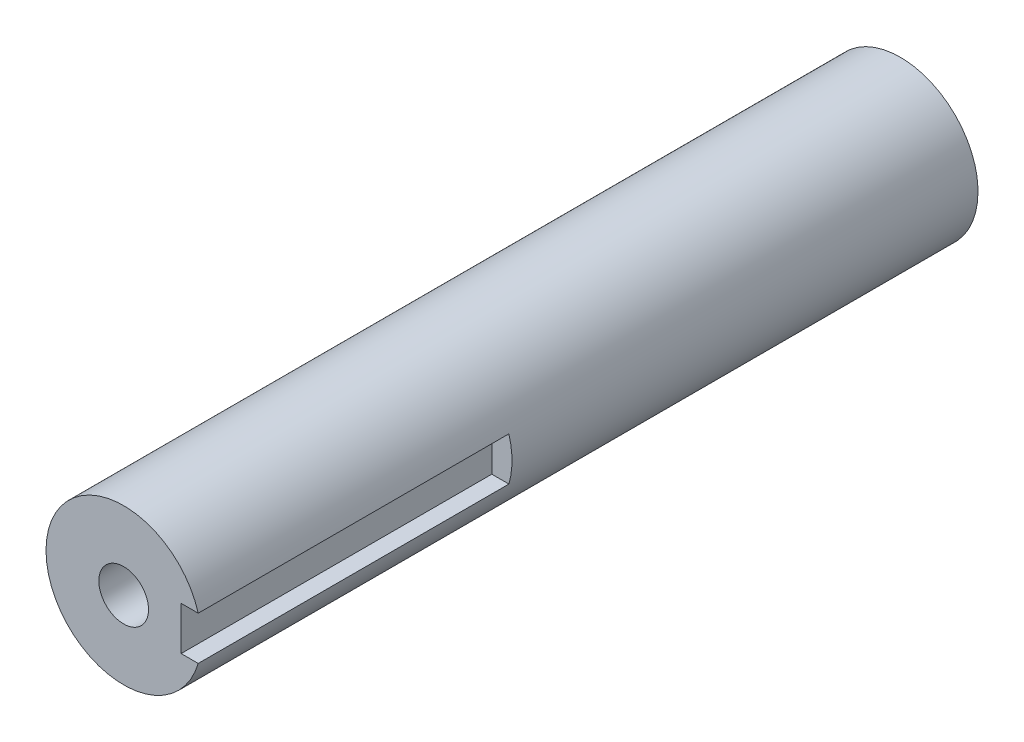
from build123d import *

# Parameters (mm, degrees)
SKETCH_1_R          = 25
EXTRUDE_1_DEPTH     = 250
SKETCH_2_W          = 14
SKETCH_2_H          = 10
CUT_EXTRUDE_1_DEPTH = 100
SKETCH_3_R          = 8
CUT_EXTRUDE_2_DEPTH = 40


with BuildPart() as part:
    # 草图1 → 凸台-拉伸1 (new body)
    with BuildSketch(Plane(origin=(0, 0, 0), x_dir=(0, -1, 0), z_dir=(0, 0, 1))):
        with Locations(Location((0, 0, 0), (0, 0, 90))):
            Circle(SKETCH_1_R)
    extrude(amount=EXTRUDE_1_DEPTH)

    # 草图2 → 切除-拉伸1 (cut)
    with BuildSketch(Plane(origin=(0, 0, 250), x_dir=(0, -1, 0), z_dir=(0, 0, 1))):
        with Locations((0, 23.5)):
            Rectangle(SKETCH_2_W, SKETCH_2_H)
    extrude(amount=-CUT_EXTRUDE_1_DEPTH, mode=Mode.SUBTRACT)

    # 草图3 → 切除-拉伸2 (cut)
    with BuildSketch(Plane.XY.offset(250)):
        Circle(SKETCH_3_R)
    extrude(amount=-CUT_EXTRUDE_2_DEPTH, mode=Mode.SUBTRACT)


solid = part.part
